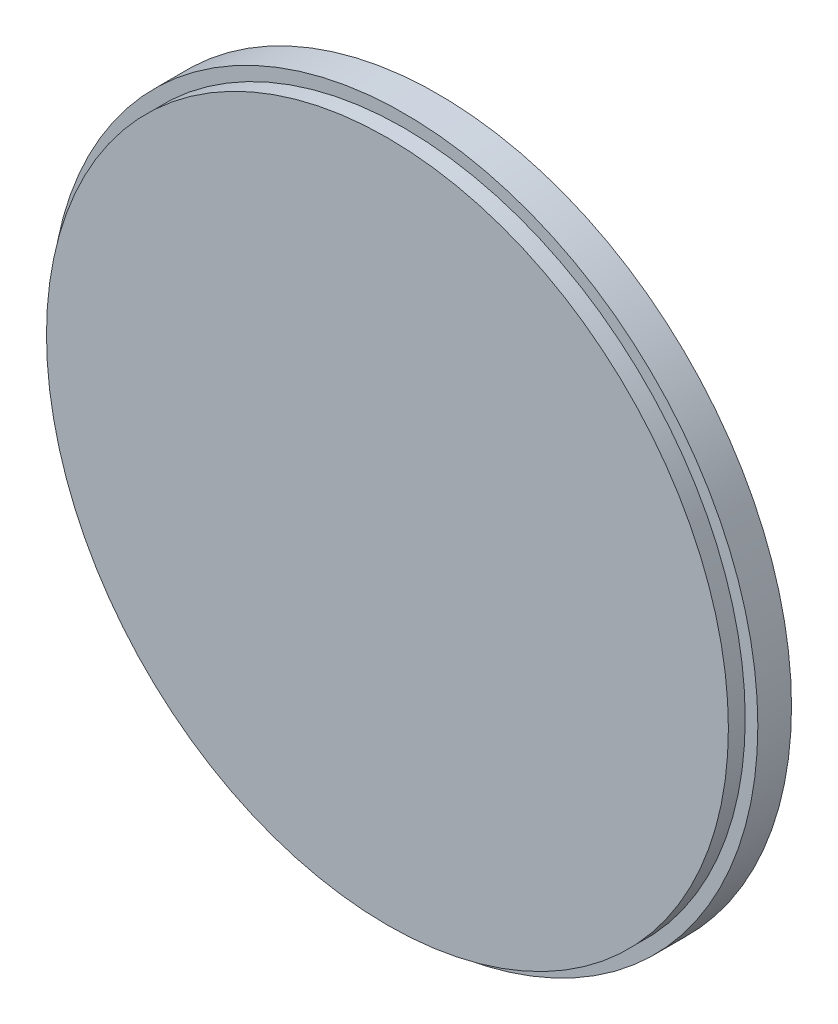
from build123d import *

# Parameters (mm, degrees)
SKETCH1_R           = 21
BOSS_EXTRUDE1_DEPTH = 2
SKETCH2_R           = 20.25
BOSS_EXTRUDE2_DEPTH = 1


with BuildPart() as part:
    # Sketch1 → Boss-Extrude1 (new body)
    with BuildSketch(Plane.XY):
        Circle(SKETCH1_R)
    extrude(amount=BOSS_EXTRUDE1_DEPTH)

    # Sketch2 → Boss-Extrude2 (add)
    with BuildSketch(Plane.XY.offset(2)):
        Circle(SKETCH2_R)
    extrude(amount=BOSS_EXTRUDE2_DEPTH)


solid = part.part
